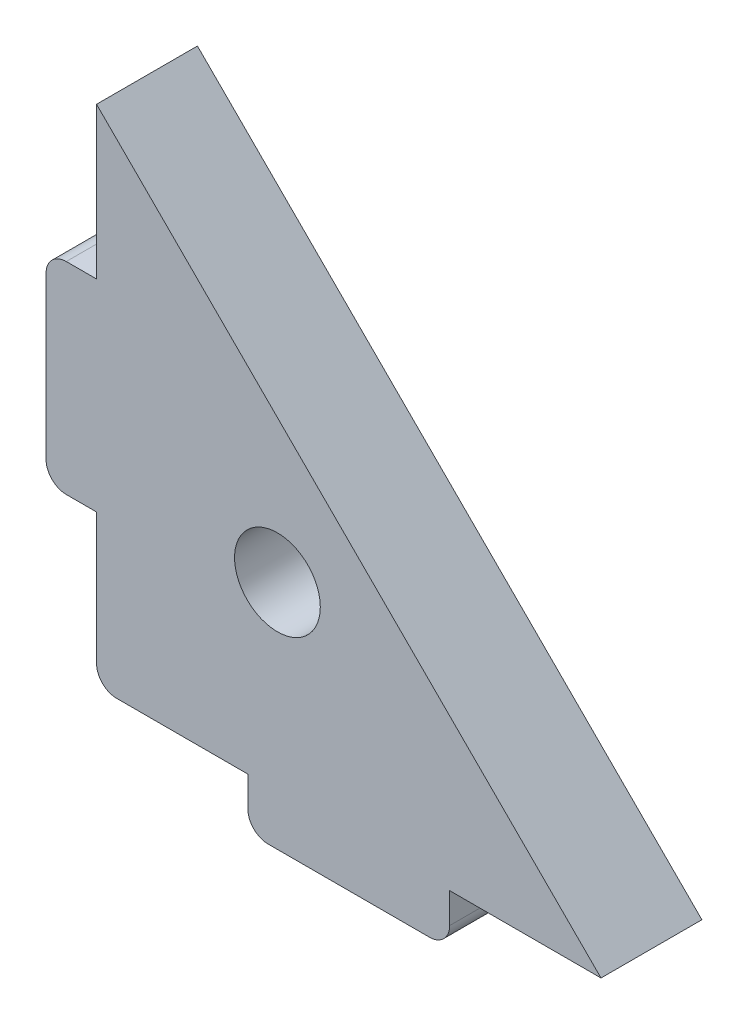
from build123d import *

# Parameters (mm, degrees)
SKETCH1_R           = 4.25
BOSS_EXTRUDE1_DEPTH = 10
FILLET1_R           = 2


with BuildPart() as part:
    # Sketch1 → Boss-Extrude1 (new body)
    with BuildSketch(Plane.XY):
        Polygon((48.252973088, 14.539348583), (-1.747026912, 64.539348583), (-1.747026912, 49.539348583), (-6.747026912, 49.539348583), (-6.747026912, 29.539348583), (-1.747026912, 29.539348583), (-1.747026912, 14.539348583), (13.252973088, 14.539348583), (13.252973088, 9.539348583), (33.252973088, 9.539348583), (33.252973088, 14.539348583), align=None)
        with Locations((16.181905276, 32.468280771)):
            Circle(SKETCH1_R, mode=Mode.SUBTRACT)
    extrude(amount=BOSS_EXTRUDE1_DEPTH)

    # Fillet1
    fillet1_edges = [part.edges().sort_by_distance(p)[0] for p in [
        (-1.747026912, 14.539348583, 5),
        (13.252973088, 9.539348583, 5),
        (33.252973088, 9.539348583, 5),
        (-6.747026912, 49.539348583, 5),
        (-6.747026912, 29.539348583, 5),
    ]]
    fillet(fillet1_edges, radius=FILLET1_R)


solid = part.part
